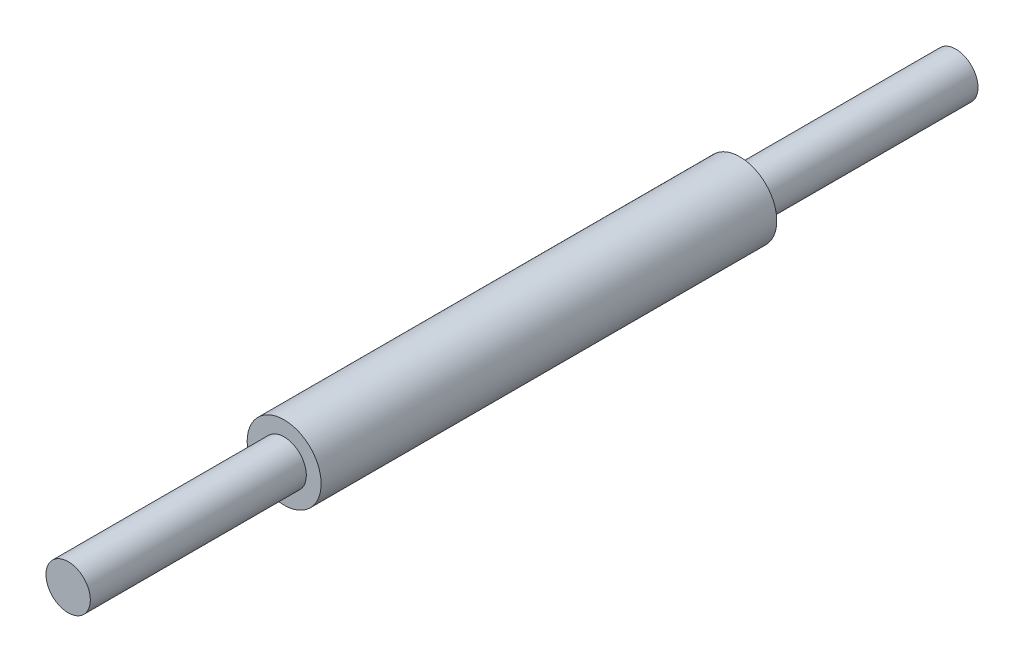
from build123d import *

# Parameters (mm, degrees)
SKETCH1_R           = 2.5
BOSS_EXTRUDE1_DEPTH = 15.4
SKETCH2_R           = 1.5
BOSS_EXTRUDE2_DEPTH = 30


with BuildPart() as part:
    # Sketch1 → Boss-Extrude1 (new, symmetric)
    with BuildSketch(Plane.XY):
        with Locations(Location((0, 0, 0), (0, 0, 180))):
            Circle(SKETCH1_R)
    extrude(amount=BOSS_EXTRUDE1_DEPTH, both=True)

    # Sketch2 → Boss-Extrude2 (add, symmetric)
    with BuildSketch(Plane.XY):
        Circle(SKETCH2_R)
    extrude(amount=BOSS_EXTRUDE2_DEPTH, both=True)


solid = part.part
